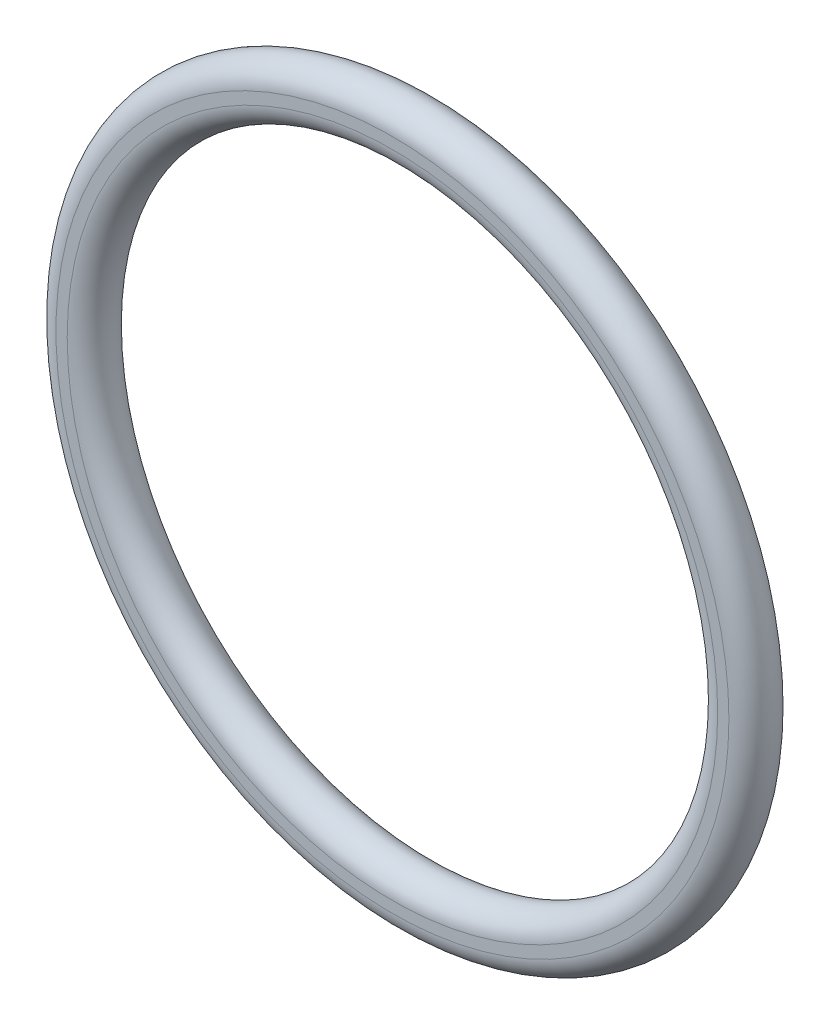
from build123d import *


with BuildPart() as part:
    # Sketch1 → Revolve1 (revolve)
    with BuildSketch(Plane(origin=(0, 0, 0), x_dir=(1, 0, 0), z_dir=(0, 1, 0))):
        with BuildLine():
            Line((23.01875, 1.5875), (23.8125, 1.5875))
            ThreePointArc((23.8125, 1.5875), (25.4, 0), (23.8125, -1.5875))
            Line((23.8125, -1.5875), (23.01875, -1.5875))
            ThreePointArc((23.01875, -1.5875), (21.43125, 0), (23.01875, 1.5875))
        make_face()
    revolve(axis=Axis((0, 0, 0), (0, 0, -1)))


solid = part.part
